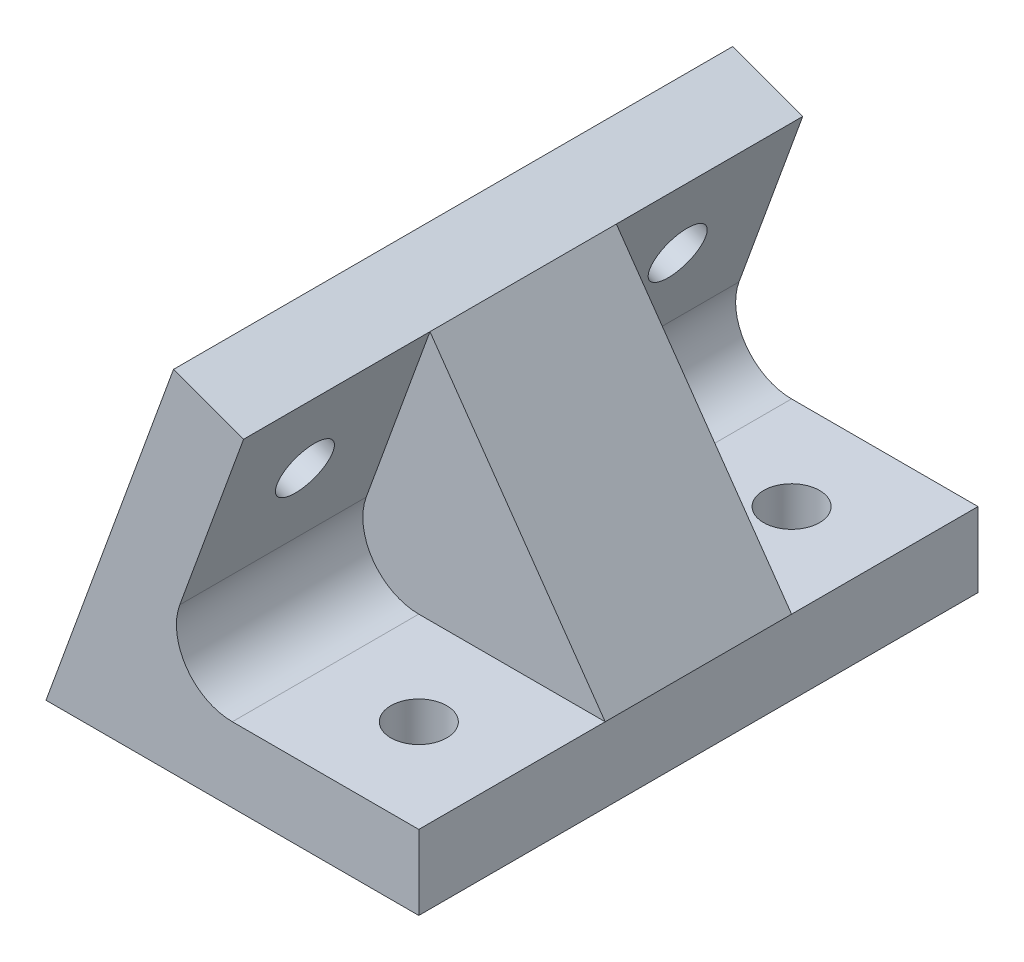
from build123d import *

# Parameters (mm, degrees)
EXTRUDE_1_DEPTH     = 30
SKETCH_2_R          = 1.5
CUT_EXTRUDE_1_DEPTH = 5
RIB_11_REACH        = 33.276
SKETCH_3_WALL_W     = 80.94250335
SKETCH_3_WALL_H     = 10
FILLET_1_R          = 3


with BuildPart() as part:
    # 草图1 → 凸台-拉伸1 (new body)
    with BuildSketch(Plane.XY):
        Polygon((0, 0), (20, 0), (20, 4), (5.712592027, 4), (10.59917335, 17.425771842), (6.840402867, 18.793852416), align=None)
    extrude(amount=EXTRUDE_1_DEPTH)

    # 草图2 → 切除-拉伸1 (cut)
    with BuildSketch(Plane.XZ):
        with Locations(Location((15, 25, 0), (0, 0, 270))):
            Circle(SKETCH_2_R)
        with Locations((15, 5)):
            Circle(SKETCH_2_R)
    cut_extrude_1 = extrude(amount=-CUT_EXTRUDE_1_DEPTH, mode=Mode.SUBTRACT)

    # 镜向1: 切除-拉伸1 across plane
    add(cut_extrude_1.mirror(Plane(origin=(0, 0, 0), x_dir=(0, 0, 1), z_dir=(-0.5735764363510445, 0.8191520442889929, 0))), mode=Mode.SUBTRACT)

    # 草图3 wall → 筋11 (add, up to next)
    with BuildSketch(Plane(origin=(15.299586675, 10.712885921, 15), x_dir=(0.573576436349, -0.81915204429, 0), z_dir=(0.81915204429, 0.573576436349, 0)), mode=Mode.PRIVATE) as rib_11_sk1:
        Rectangle(SKETCH_3_WALL_W, SKETCH_3_WALL_H)
    rib_11_tool1 = extrude(rib_11_sk1.sketch, amount=-RIB_11_REACH, mode=Mode.PRIVATE) - part.part
    add(rib_11_tool1.solids().sort_by_distance((15.299586675, 10.712885921, 15))[0])

    # 圆角1
    fillet_1_edges = [part.edges().sort_by_distance(p)[0] for p in [
        (5.712592027, 4, 25),
        (5.712592027, 4, 5),
    ]]
    fillet(fillet_1_edges, radius=FILLET_1_R)


solid = part.part
